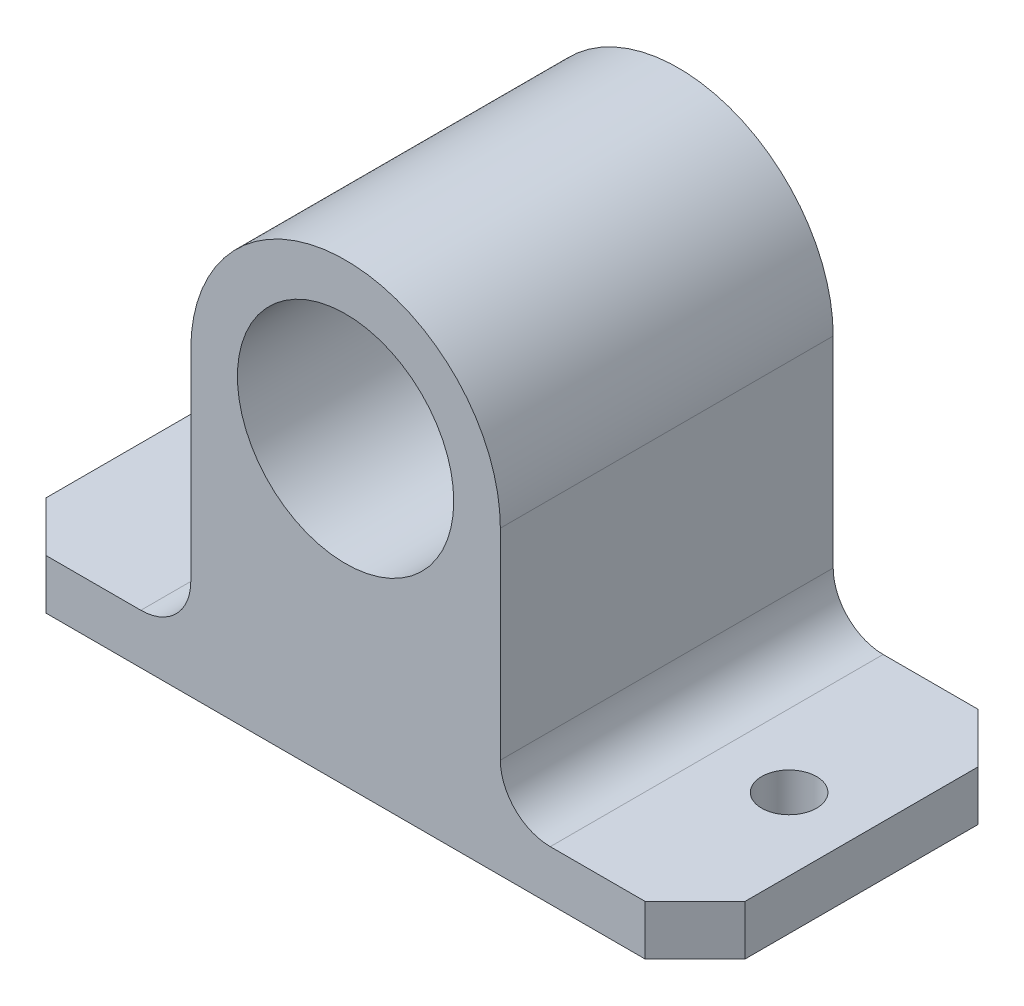
from build123d import *

# Parameters (mm, degrees)
SKETCH1_R           = 6.5
BOSS_EXTRUDE1_DEPTH = 20
CHAMFER1_SIZE       = 3
SKETCH2_R           = 1.65
CUT_EXTRUDE1_DEPTH  = 20


with BuildPart() as part:
    # Sketch1 → Boss-Extrude1 (new body)
    with BuildSketch(Plane.XY):
        with BuildLine():
            Line((-21, -18.072367328), (21, -18.072367328))
            Line((21, -18.072367328), (21, -15.072367328))
            Line((21, -15.072367328), (12.3, -15.072367328))
            ThreePointArc((12.3, -15.072367328), (10.178679656, -14.193687672), (9.3, -12.072367328))
            Line((9.3, -12.072367328), (9.3, 0))
            ThreePointArc((9.3, 0), (0, 9.3), (-9.3, 0))
            Line((-9.3, 0), (-9.3, -12.072367328))
            ThreePointArc((-9.3, -12.072367328), (-10.178679656, -14.193687672), (-12.3, -15.072367328))
            Line((-12.3, -15.072367328), (-21, -15.072367328))
            Line((-21, -15.072367328), (-21, -18.072367328))
        make_face()
        Circle(SKETCH1_R, mode=Mode.SUBTRACT)
    extrude(amount=BOSS_EXTRUDE1_DEPTH)

    # Chamfer1
    chamfer1_edges = [part.edges().sort_by_distance(p)[0] for p in [
        (21, -16.572367328, 20),
        (21, -16.572367328, 0),
        (-21, -16.572367328, 0),
        (-21, -16.572367328, 20),
    ]]
    chamfer(chamfer1_edges, length=CHAMFER1_SIZE)

    # Sketch2 → Cut-Extrude1 (cut)
    with BuildSketch(Plane(origin=(0, -15.072367328, 0), x_dir=(1, 0, 0), z_dir=(0, 1, 0))):
        with Locations(Location((16.65, -10, 0), (0, 0, 180))):
            Circle(SKETCH2_R)
        with Locations(Location((-16.65, -10, 0), (0, 0, 180))):
            Circle(SKETCH2_R)
    extrude(amount=-CUT_EXTRUDE1_DEPTH, mode=Mode.SUBTRACT)


solid = part.part
